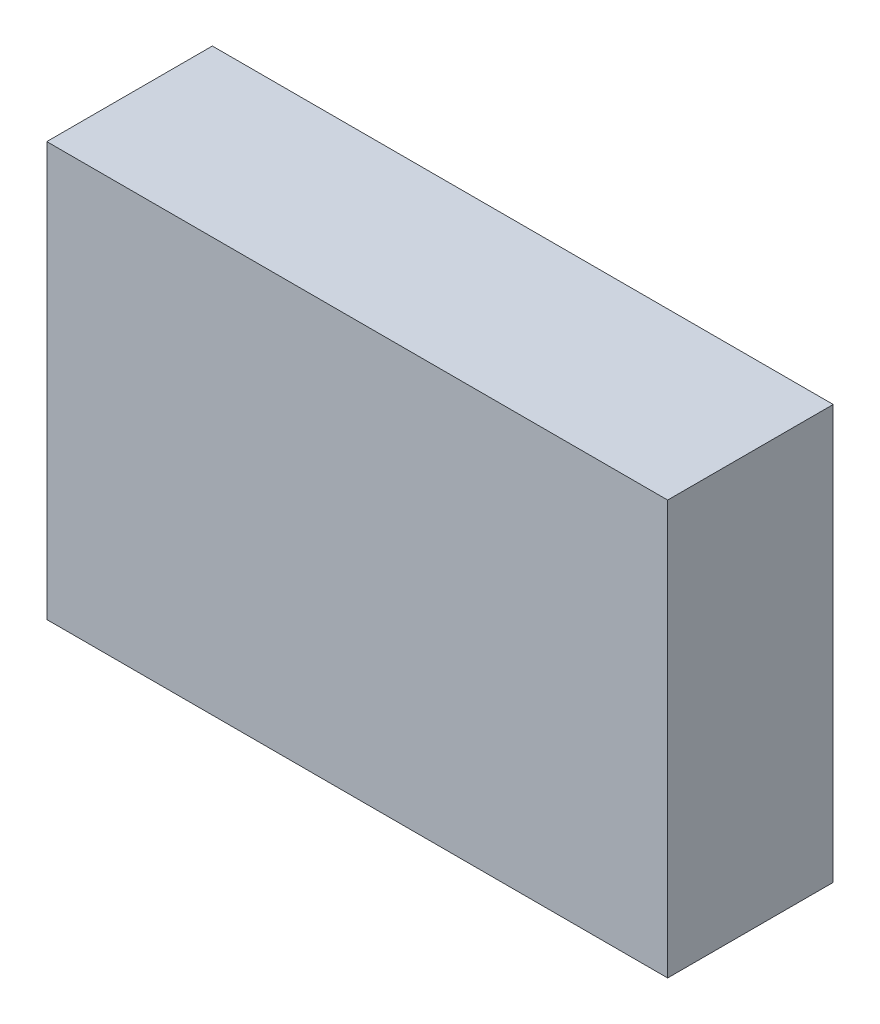
from build123d import *

# Parameters (mm, degrees)
SKETCH_1_W      = 75
SKETCH_1_H      = 50
EXTRUDE_1_DEPTH = 20


with BuildPart() as part:
    # 草图1 → 凸台-拉伸1 (new body)
    with BuildSketch(Plane.XY):
        Rectangle(SKETCH_1_W, SKETCH_1_H)
    extrude(amount=EXTRUDE_1_DEPTH)


solid = part.part
